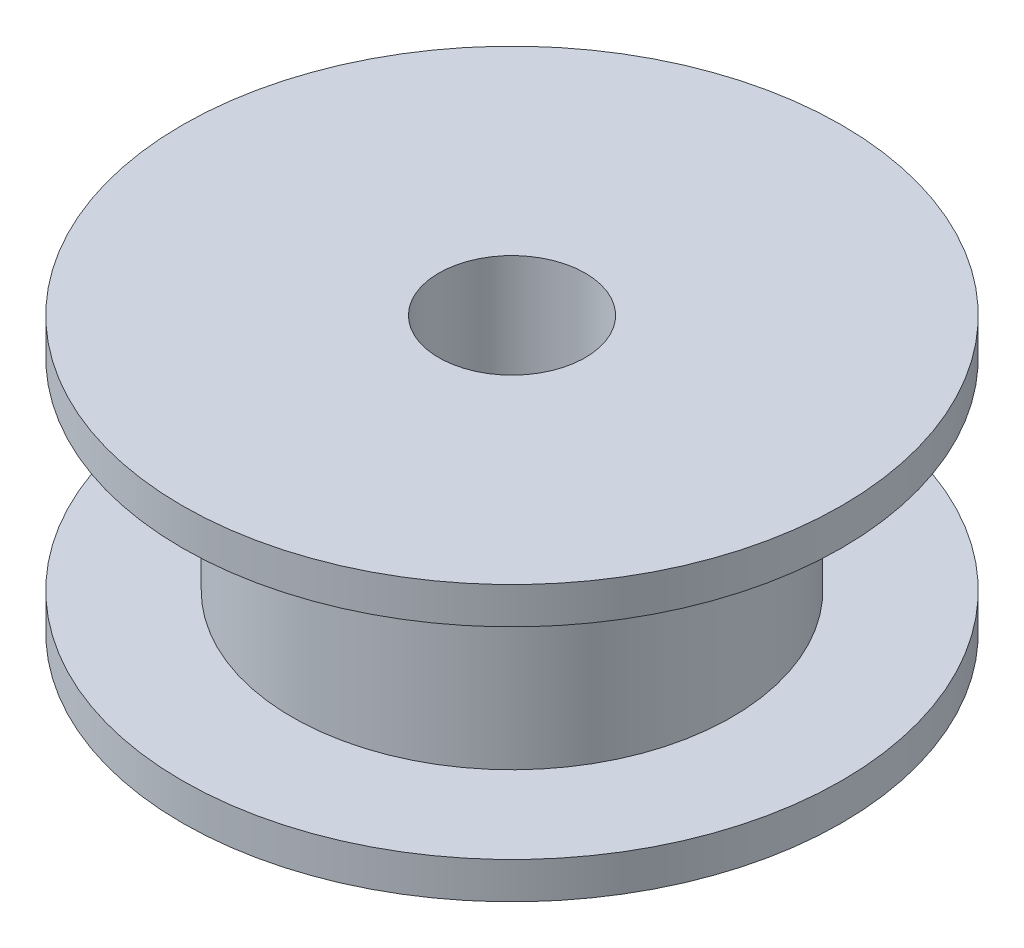
from build123d import *

# Parameters (mm, degrees)
SKIZZE1_R                       = 9
SKIZZE1_R_2                     = 6
AUFSATZ_LINEAR_AUSTRAGEN1_DEPTH = 1
SKIZZE1_3_R                     = 6
SKIZZE1_3_R_2                   = 2
AUFSATZ_LINEAR_AUSTRAGEN2_DEPTH = 6.5
SKIZZE2_R                       = 9
SKIZZE2_R_2                     = 2
AUFSATZ_LINEAR_AUSTRAGEN3_DEPTH = 1


with BuildPart() as part:
    # Skizze1 → Aufsatz-Linear austragen1 (new body)
    with BuildSketch(Plane(origin=(0, 0, 0), x_dir=(1, 0, 0), z_dir=(0, 1, 0))):
        Circle(SKIZZE1_R)
        Circle(SKIZZE1_R_2, mode=Mode.SUBTRACT)
    extrude(amount=AUFSATZ_LINEAR_AUSTRAGEN1_DEPTH)

    # Skizze1<3> → Aufsatz-Linear austragen2 (add)
    with BuildSketch(Plane(origin=(0, 0, 0), x_dir=(1, 0, 0), z_dir=(0, 1, 0))):
        Circle(SKIZZE1_3_R)
        Circle(SKIZZE1_3_R_2, mode=Mode.SUBTRACT)
    extrude(amount=AUFSATZ_LINEAR_AUSTRAGEN2_DEPTH)

    # Skizze2 → Aufsatz-Linear austragen3 (add)
    with BuildSketch(Plane(origin=(0, 6.5, 0), x_dir=(1, 0, 0), z_dir=(0, 1, 0))):
        Circle(SKIZZE2_R)
        Circle(SKIZZE2_R_2, mode=Mode.SUBTRACT)
    extrude(amount=AUFSATZ_LINEAR_AUSTRAGEN3_DEPTH)


solid = part.part
